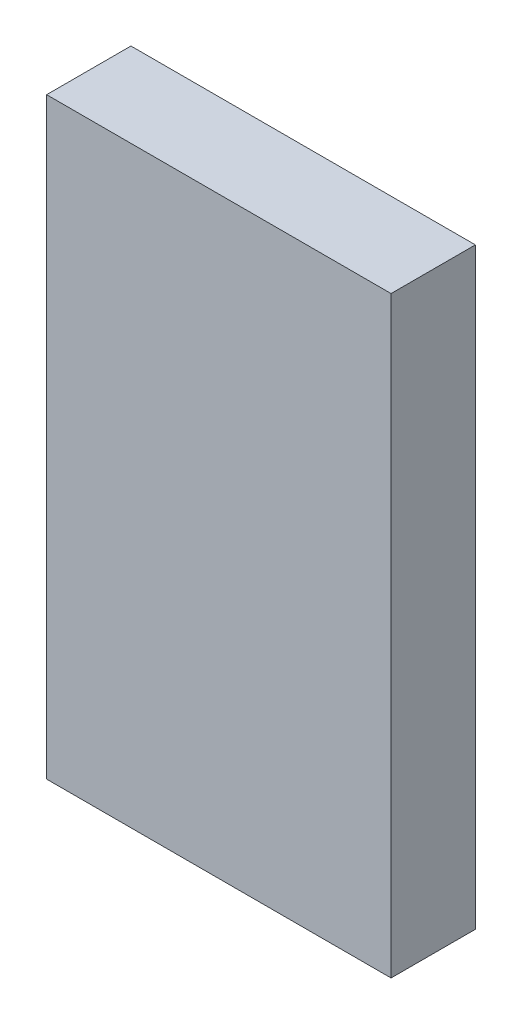
from build123d import *

# Parameters (mm, degrees)
SKETCH1_W           = 81.7
SKETCH1_H           = 140.6
BOSS_EXTRUDE1_DEPTH = 10


with BuildPart() as part:
    # Sketch1 → Boss-Extrude1 (new, symmetric)
    with BuildSketch(Plane.XY):
        Rectangle(SKETCH1_W, SKETCH1_H)
    extrude(amount=BOSS_EXTRUDE1_DEPTH, both=True)


solid = part.part
